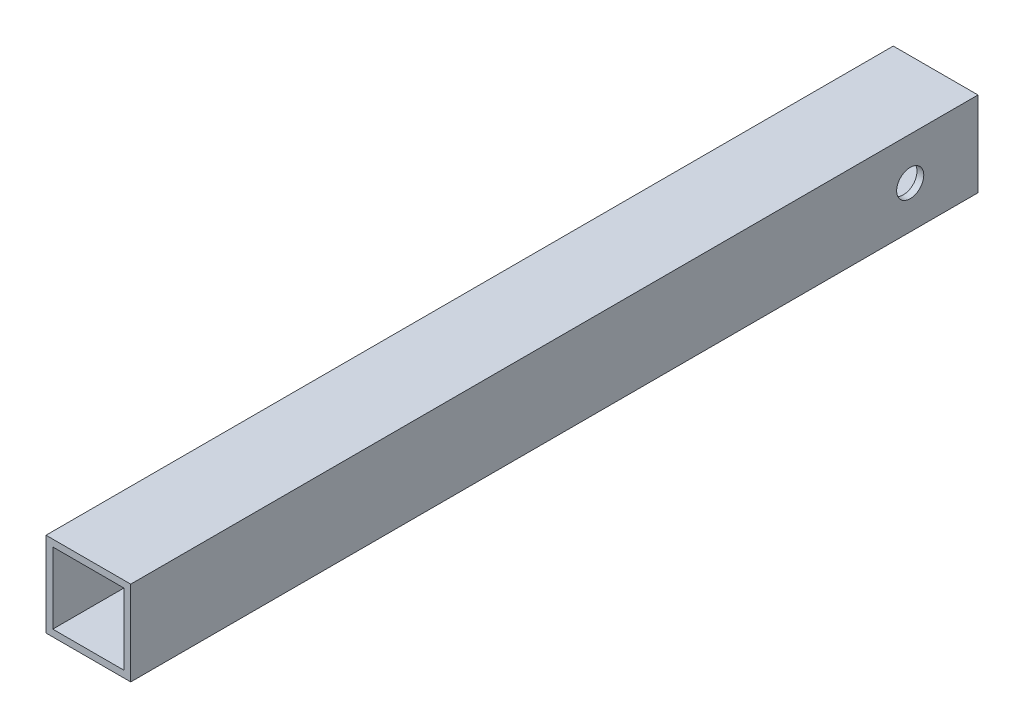
from build123d import *

# Parameters (mm, degrees)
SKETCH2_W           = 25
SKETCH2_H           = 25
SKETCH2_W_2         = 21
SKETCH2_H_2         = 21
EXTRUDE_THIN1_DEPTH = 125
SKETCH3_R           = 4
HOLE_DEPTH          = 129.086884574


with BuildPart() as part:
    # Sketch2 → Extrude-Thin1 (new, symmetric)
    with BuildSketch(Plane.XY):
        Rectangle(SKETCH2_W, SKETCH2_H)
        Rectangle(SKETCH2_W_2, SKETCH2_H_2, mode=Mode.SUBTRACT)
    extrude(amount=EXTRUDE_THIN1_DEPTH, both=True)

    # Sketch3 → hole (cut, through all)
    with BuildSketch(Plane(origin=(12.5, 0, 0), x_dir=(0, 0, -1), z_dir=(1, 0, 0))):
        with Locations((105, 0)):
            Circle(SKETCH3_R)
    extrude(amount=-HOLE_DEPTH, mode=Mode.SUBTRACT)


solid = part.part
